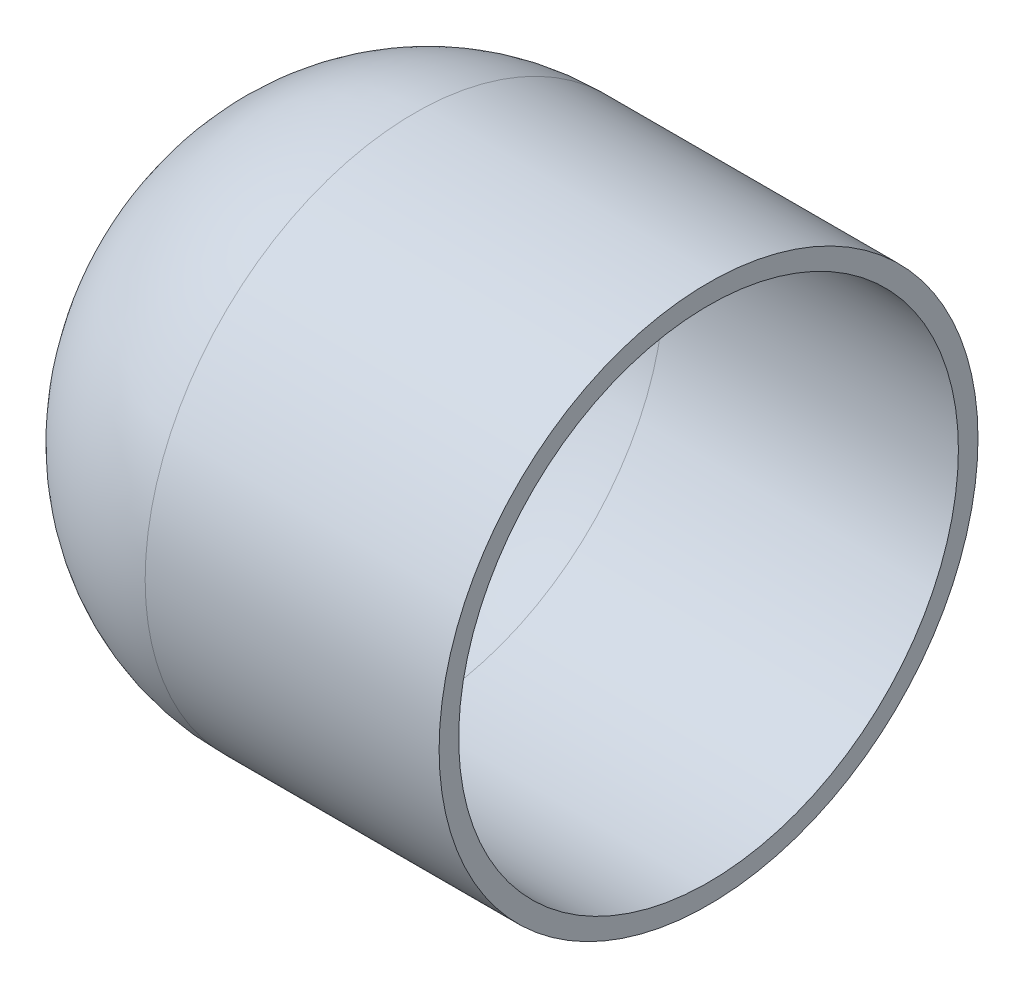
from build123d import *


with BuildPart() as part:
    # Çizim2 → Döndür2 (revolve)
    with BuildSketch(Plane.XY, mode=Mode.PRIVATE) as d_nd_r2_sk:
        with BuildLine():
            Line((0, 27.5), (-30, 27.5))
            ThreePointArc((-30, 27.5), (-41.957454175, 24.418807423), (-50.8, 15.8))
            Line((-50.8, 15.8), (-50.8, 13.8))
            ThreePointArc((-50.8, 13.8), (-42.068120997, 22.615548438), (-30, 25.5))
            Line((-30, 25.5), (0, 25.5))
            Line((0, 25.5), (0, 27.5))
        make_face()
    revolve(d_nd_r2_sk.sketch.rotate(Axis((0, 0, 0), (-1, 0, 0)), 90), axis=Axis((0, 0, 0), (-1, 0, 0)))


solid = part.part
